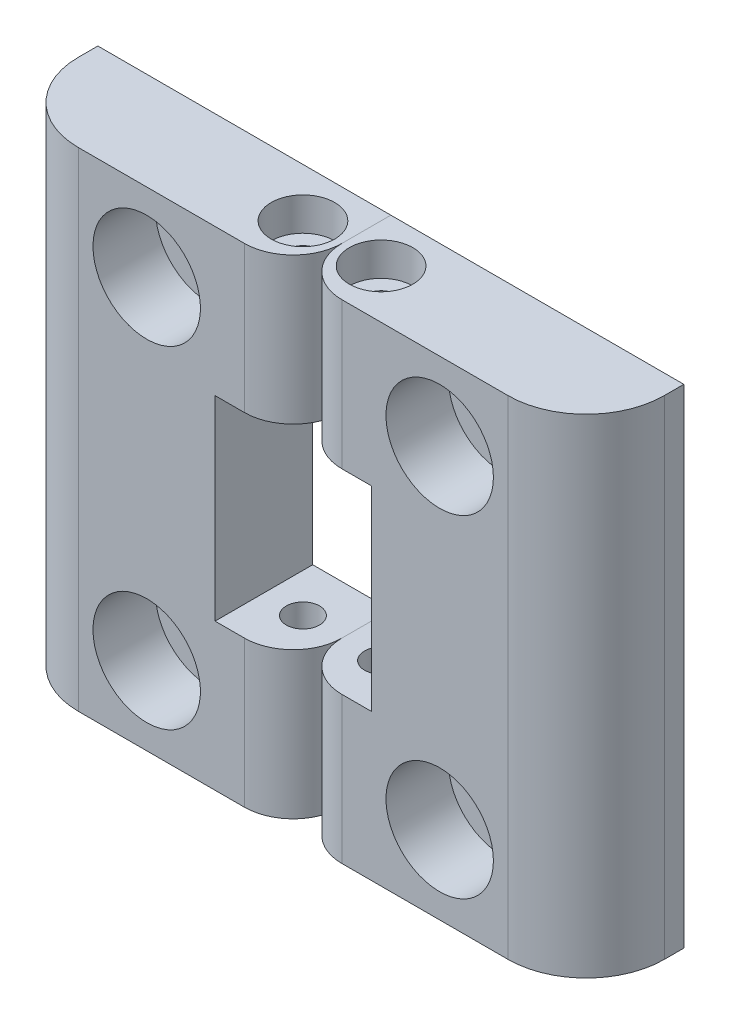
from build123d import *

# Parameters (mm, degrees)
BASE_DEPTH               = 10
MOUNT_HOLES_D            = 6.6
MOUNT_HOLES_CBORE_D      = 11
MOUNT_HOLES_CBORE_DEPTH  = 6.4
TOP_HINGE_D              = 3.4
TOP_HINGE_DEPTH          = 15
TOP_HINGE_CBORE_D        = 6.5
TOP_HINGE_CBORE_DEPTH    = 3.4
BOTTOM_HINGE_D           = 3.4
BOTTOM_HINGE_CBORE_D     = 3.8
BOTTOM_HINGE_CBORE_DEPTH = 8
PROFILE_CLICK_DEPTH      = 3
HINGE_ROUND_R            = 5
ZAOBLIT2_R               = 8


with BuildPart() as part:
    # Base sketch → Base (new body)
    with BuildSketch(Plane.XY):
        Polygon((-15, 25), (-15, 10), (-7, 10), (-7, -10), (-15, -10), (-15, -25), (15, -25), (15, 25), align=None)
    extrude(amount=BASE_DEPTH)

    # Mount holes (through all)
    with Locations(Plane.XY.offset(10)):
        with Locations((0, 17), (0, -17)):
            CounterBoreHole(MOUNT_HOLES_D / 2, MOUNT_HOLES_CBORE_D / 2, MOUNT_HOLES_CBORE_DEPTH)

    # Top hinge
    with Locations(Plane(origin=(0, 25, 0), x_dir=(1, 0, 0), z_dir=(0, 1, 0))):
        with Locations((-11, -5)):
            CounterBoreHole(TOP_HINGE_D / 2, TOP_HINGE_CBORE_D / 2, TOP_HINGE_CBORE_DEPTH, depth=TOP_HINGE_DEPTH)

    # Bottom hinge (through all)
    with Locations(Plane(origin=(0, -25, 0), x_dir=(-1, 0, 0), z_dir=(0, -1, 0))):
        with Locations((11, -5)):
            CounterBoreHole(BOTTOM_HINGE_D / 2, BOTTOM_HINGE_CBORE_D / 2, BOTTOM_HINGE_CBORE_DEPTH)

    # profile sketch → Profile click (add)
    with BuildSketch(Plane(origin=(0, 0, 0), x_dir=(-1, 0, 0), z_dir=(0, 0, -1))):
        with BuildLine():
            ThreePointArc((4, 10.07179677), (0, 9), (-4, 10.07179677))
            Line((-4, 10.07179677), (-4, -10.07179677))
            ThreePointArc((-4, -10.07179677), (0, -9), (4, -10.07179677))
            Line((4, -10.07179677), (4, 10.07179677))
        make_face()
    extrude(amount=PROFILE_CLICK_DEPTH)

    # Hinge round
    hinge_round_edges = [part.edges().sort_by_distance(p)[0] for p in [
        (-15, -17.5, 10),
        (-15, 17.5, 10),
    ]]
    fillet(hinge_round_edges, radius=HINGE_ROUND_R)

    # Zaoblit2
    zaoblit2_edges = [part.edges().sort_by_distance(p)[0] for p in [
        (15, 0, 10),
    ]]
    fillet(zaoblit2_edges, radius=ZAOBLIT2_R)


with BuildPart() as body_2:
    # Mirror R: mirrored copy
    add(part.part.mirror(Plane(origin=(-15, 0, 10), x_dir=(0, 0, 1), z_dir=(1, 0, 0))))


solid = Compound([part.part, body_2.part])
